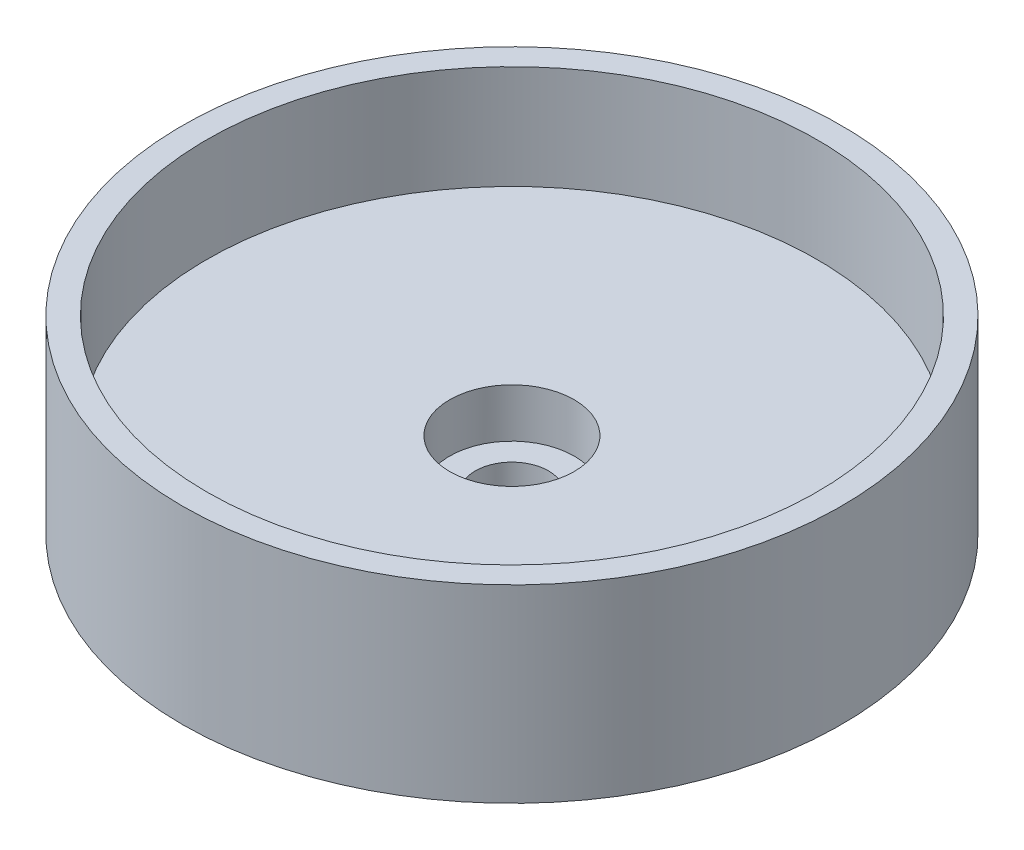
from build123d import *

# Parameters (mm, degrees)
ESQUISSE1_R             = 25
ESQUISSE1_R_2           = 5.1
BOSS_EXTRU_1_DEPTH      = 7
ESQUISSE2_R             = 25
ESQUISSE2_R_2           = 3
BOSS_EXTRU_2_DEPTH      = 3
BOSS_EXTRU_3_DEPTH      = 8.5
BOSS_EXTRU_3_DEPTH_BACK = 7
ESQUISSE3_R             = 27
ESQUISSE3_R_2           = 25


with BuildPart() as part:
    # Esquisse1 → Boss.-Extru.1 (new body)
    with BuildSketch(Plane(origin=(0, 0, 0), x_dir=(1, 0, 0), z_dir=(0, 1, 0))):
        with Locations(Location((0, 0, 0), (0, 0, 270))):
            Circle(ESQUISSE1_R)
        with Locations(Location((0, 0, 0), (0, 0, 270))):
            Circle(ESQUISSE1_R_2, mode=Mode.SUBTRACT)
    extrude(amount=BOSS_EXTRU_1_DEPTH)

    # Esquisse2 → Boss.-Extru.2 (add)
    with BuildSketch(Plane.XZ):
        with Locations(Location((0, 0, 0), (0, 0, 90))):
            Circle(ESQUISSE2_R)
        with Locations(Location((0, 0, 0), (0, 0, 270))):
            Circle(ESQUISSE2_R_2, mode=Mode.SUBTRACT)
    extrude(amount=-BOSS_EXTRU_2_DEPTH)

    # Esquisse3 → Boss.-Extru.3 (add, two sides: drawn at the far end of the back side and taken through both)
    with BuildSketch(Plane(origin=(0, 7, 0), x_dir=(1, 0, 0), z_dir=(0, 1, 0)).offset(-BOSS_EXTRU_3_DEPTH_BACK)):
        with Locations(Location((0, 0, 0), (0, 0, 270))):
            Circle(ESQUISSE3_R)
        with Locations(Location((0, 0, 0), (0, 0, 270))):
            Circle(ESQUISSE3_R_2, mode=Mode.SUBTRACT)
    extrude(amount=BOSS_EXTRU_3_DEPTH + BOSS_EXTRU_3_DEPTH_BACK)


solid = part.part
